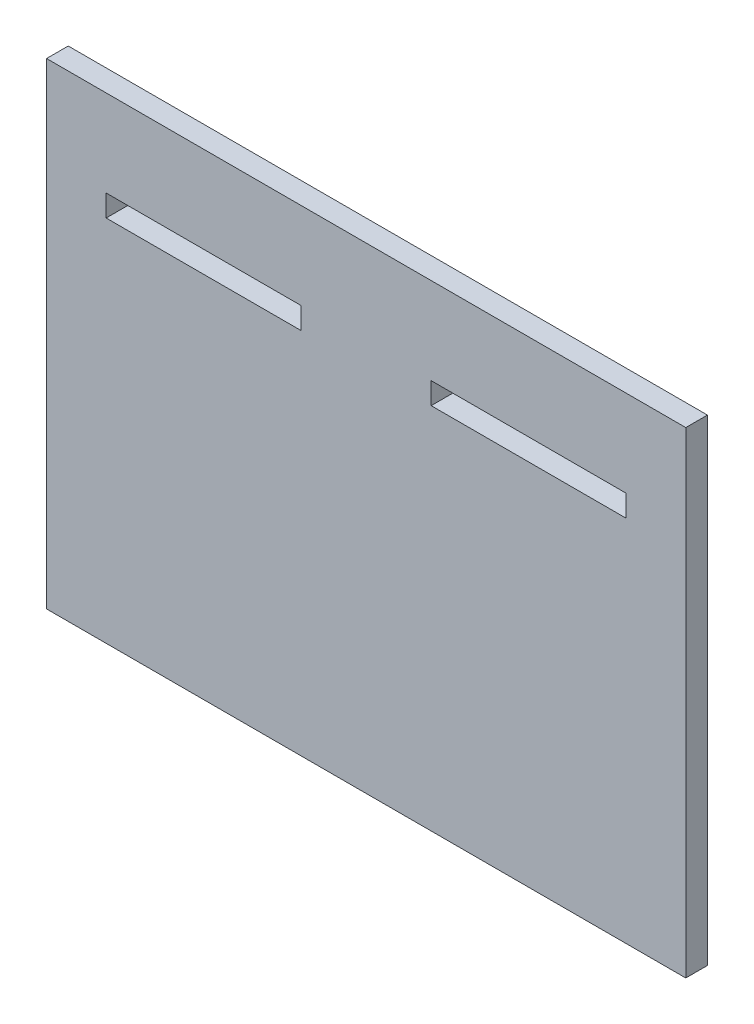
from build123d import *

# Parameters (mm, degrees)
ESQUISSE1_W        = 295
ESQUISSE1_H        = 220
ESQUISSE1_W_2      = 90
ESQUISSE1_H_2      = 10
BOSS_EXTRU_1_DEPTH = 10


with BuildPart() as part:
    # Esquisse1 → Boss.-Extru.1 (new body)
    with BuildSketch(Plane.XY):
        with Locations((147.5, 110)):
            Rectangle(ESQUISSE1_W, ESQUISSE1_H)
        with Locations((72.5, 175)):
            Rectangle(ESQUISSE1_W_2, ESQUISSE1_H_2, mode=Mode.SUBTRACT)
        with Locations((222.5, 175)):
            Rectangle(ESQUISSE1_W_2, ESQUISSE1_H_2, mode=Mode.SUBTRACT)
    extrude(amount=BOSS_EXTRU_1_DEPTH)


solid = part.part
